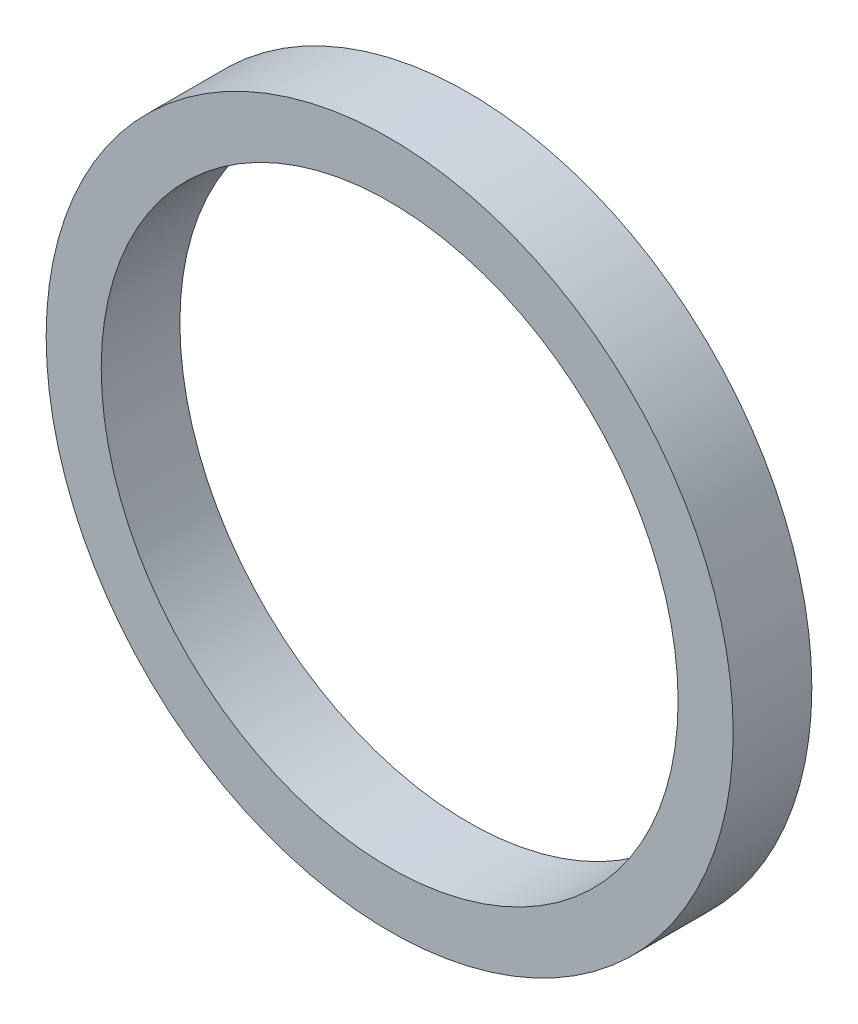
from build123d import *

# Parameters (mm, degrees)
SKETCH1_R           = 13.1
SKETCH1_R_2         = 11
BOSS_EXTRUDE1_DEPTH = 1.5


with BuildPart() as part:
    # Sketch1 → Boss-Extrude1 (new, symmetric)
    with BuildSketch(Plane.XY):
        Circle(SKETCH1_R)
        Circle(SKETCH1_R_2, mode=Mode.SUBTRACT)
    extrude(amount=BOSS_EXTRUDE1_DEPTH, both=True)


solid = part.part
